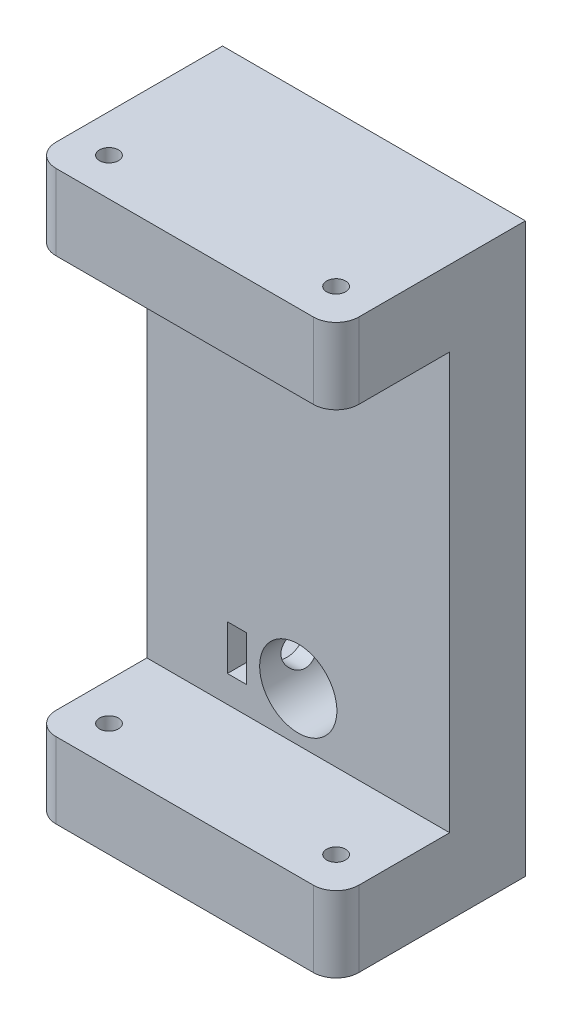
from build123d import *

# Parameters (mm, degrees)
SKETCH1_W                           = 40
SKETCH1_H                           = 75
BOSS_EXTRUDE1_DEPTH                 = 10
SKETCH2_W                           = 40
SKETCH2_H                           = 10
BOSS_EXTRUDE2_DEPTH                 = 15
SKETCH3_R                           = 1.25
CUT_EXTRUDE1_DEPTH                  = 70
FILLET1_R                           = 3
FILLET2_R                           = 3
SKETCH4_R                           = 5.1
CUT_EXTRUDE2_DEPTH                  = 10
ENL_V_MAT_EXTRU_1_REACH             = 62.26
ENL_V_MAT_EXTRU_1_END_RADIUS        = 5.1
ESQUISSE1_R                         = 2.55
ENL_V_MAT_EXTRU_1_DIRECTION_2_DEPTH = 61.259853966
ESQUISSE2_W                         = 2.5
ESQUISSE2_H                         = 5.92504729
ENL_V_MAT_EXTRU_2_DEPTH             = 50.307707349


with BuildPart() as part:
    # Sketch1 → Boss-Extrude1 (new body)
    with BuildSketch(Plane.XY):
        Rectangle(SKETCH1_W, SKETCH1_H)
    extrude(amount=BOSS_EXTRUDE1_DEPTH)

    # Sketch2 → Boss-Extrude2 (add)
    with BuildSketch(Plane.XY.offset(10)):
        with Locations((0, 32.5)):
            Rectangle(SKETCH2_W, SKETCH2_H)
        with Locations((0, -32.5)):
            Rectangle(SKETCH2_W, SKETCH2_H)
    extrude(amount=BOSS_EXTRUDE2_DEPTH)

    # Sketch3 → Cut-Extrude1 (cut)
    with BuildSketch(Plane(origin=(0, 37.5, 0), x_dir=(1, 0, 0), z_dir=(0, 1, 0))):
        with Locations(Location((-15, -20, 0), (0, 0, 270))):
            Circle(SKETCH3_R)
        with Locations(Location((15, -20, 0), (0, 0, 90))):
            Circle(SKETCH3_R)
    extrude(amount=-CUT_EXTRUDE1_DEPTH, mode=Mode.SUBTRACT)

    # Fillet1
    fillet1_edges = [part.edges().sort_by_distance(p)[0] for p in [
        (-20, 32.5, 25),
        (20, 32.5, 25),
    ]]
    fillet(fillet1_edges, radius=FILLET1_R)

    # Fillet2
    fillet2_edges = [part.edges().sort_by_distance(p)[0] for p in [
        (-20, -32.5, 25),
        (20, -32.5, 25),
    ]]
    fillet(fillet2_edges, radius=FILLET2_R)

    # Sketch4 → Cut-Extrude2 (cut)
    with BuildSketch(Plane(origin=(0, 0, 0), x_dir=(-1, 0, 0), z_dir=(0, 0, -1))):
        with Locations((0, -21)):
            Circle(SKETCH4_R)
    extrude(amount=-CUT_EXTRUDE2_DEPTH, mode=Mode.SUBTRACT)

    # Enlèv. mat.-Extru.1: up to this cylinder (the profile starts outside it)
    enl_v_mat_extru_1_end = Plane(origin=(0, -21, 4.63857), z_dir=(0, 0, -1)) * Cylinder(ENL_V_MAT_EXTRU_1_END_RADIUS, 135.72, mode=Mode.PRIVATE)
    # Esquisse1 → Enlèv. mat.-Extru.1 (cut, up to the surface)
    with BuildSketch(Plane.ZY.offset(20), mode=Mode.PRIVATE) as enl_v_mat_extru_1_sk1:
        with Locations(Location((4.63857049, -21, 0), (0, 0, 180))):
            Circle(ESQUISSE1_R)
    enl_v_mat_extru_1_tool1 = extrude(enl_v_mat_extru_1_sk1.sketch, amount=-ENL_V_MAT_EXTRU_1_REACH, mode=Mode.PRIVATE) - enl_v_mat_extru_1_end
    add(enl_v_mat_extru_1_tool1.solids().sort_by_distance((-20, -21, 4.63857))[0], mode=Mode.SUBTRACT)

    # Esquisse1 → Enlèv. mat.-Extru.1 direction 2 (cut)
    with BuildSketch(Plane.ZY.offset(20)):
        with Locations(Location((4.63857049, -21, 0), (0, 0, 180))):
            Circle(ESQUISSE1_R)
    extrude(amount=ENL_V_MAT_EXTRU_1_DIRECTION_2_DEPTH, mode=Mode.SUBTRACT)

    # Esquisse2 → Enlèv. mat.-Extru.2 (cut, through all)
    with BuildSketch(Plane(origin=(0, 0, 0), x_dir=(-1, 0, 0), z_dir=(0, 0, -1))):
        with Locations((8.108583092, -21)):
            Rectangle(ESQUISSE2_W, ESQUISSE2_H)
    extrude(amount=-ENL_V_MAT_EXTRU_2_DEPTH, mode=Mode.SUBTRACT)


solid = part.part
